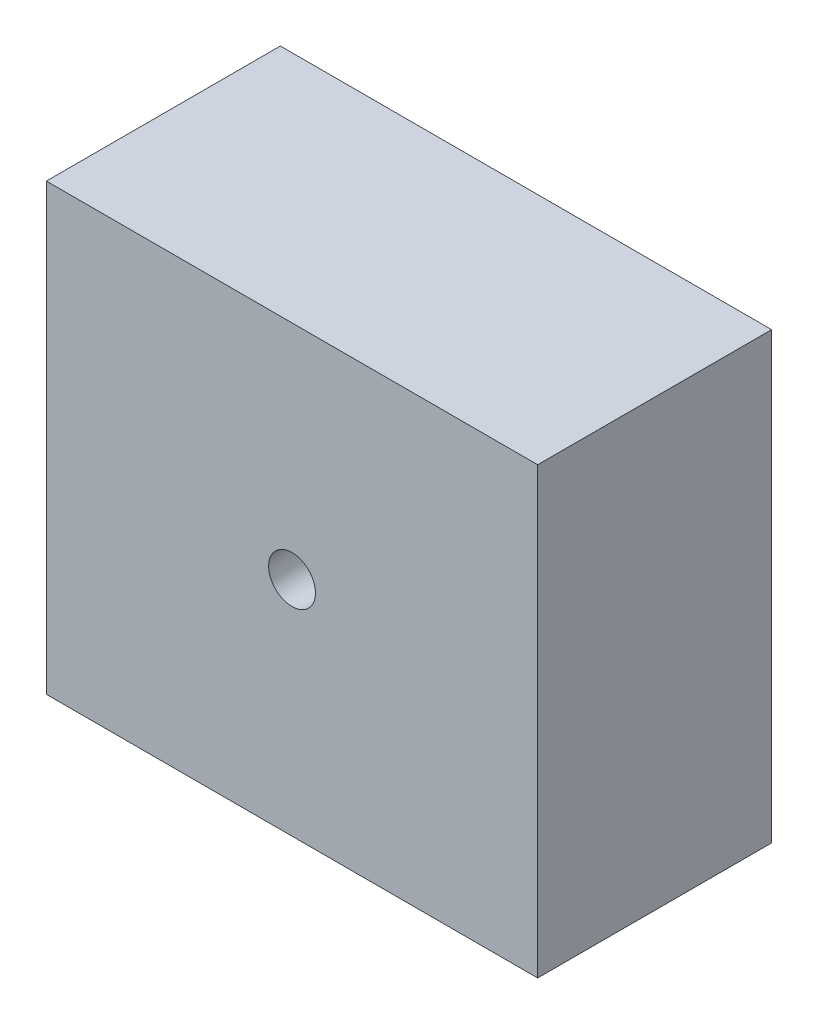
from build123d import *

# Parameters (mm, degrees)
SKETCH1_W           = 21
SKETCH1_H           = 19
BOSS_EXTRUDE2_DEPTH = 10
SKETCH3_W           = 16.2
SKETCH3_H           = 14.2
CUT_EXTRUDE1_DEPTH  = 2.019279387
SKETCH4_R           = 1
CUT_EXTRUDE2_DEPTH  = 8


with BuildPart() as part:
    # Sketch1 → Boss-Extrude2 (new body)
    with BuildSketch(Plane.XY):
        Rectangle(SKETCH1_W, SKETCH1_H)
    extrude(amount=BOSS_EXTRUDE2_DEPTH)

    # Sketch3 → Cut-Extrude1 (cut)
    with BuildSketch(Plane(origin=(0, 0, 0), x_dir=(-1, 0, 0), z_dir=(0, 0, -1))):
        Rectangle(SKETCH3_W, SKETCH3_H)
    extrude(amount=-CUT_EXTRUDE1_DEPTH, mode=Mode.SUBTRACT)

    # Sketch4 → Cut-Extrude2 (cut)
    with BuildSketch(Plane(origin=(0, 0, 2.019279387), x_dir=(-1, 0, 0), z_dir=(0, 0, -1))):
        Circle(SKETCH4_R)
    extrude(amount=-CUT_EXTRUDE2_DEPTH, mode=Mode.SUBTRACT)


solid = part.part
